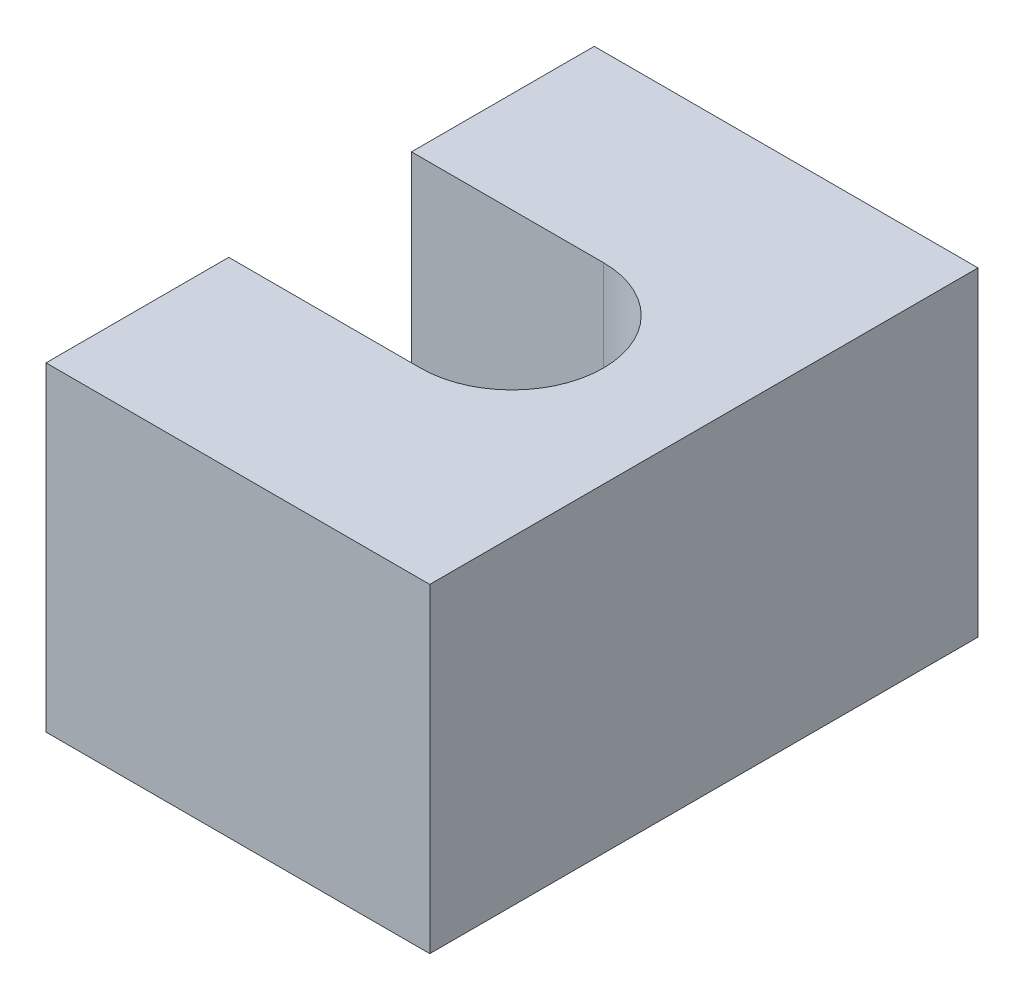
from build123d import *

# Parameters (mm, degrees)
SKETCH1_W           = 42
SKETCH1_H           = 60
BOSS_EXTRUDE1_DEPTH = 10
BOSS_EXTRUDE2_DEPTH = 25
SKETCH3_R           = 4
CUT_EXTRUDE1_DEPTH  = 15
SKETCH4_R           = 2.5
CUT_EXTRUDE2_DEPTH  = 15


with BuildPart() as part:
    # Sketch1 → Boss-Extrude1 (new body)
    with BuildSketch(Plane(origin=(0, 0, 0), x_dir=(1, 0, 0), z_dir=(0, 1, 0))):
        with Locations((21, 30)):
            Rectangle(SKETCH1_W, SKETCH1_H)
    extrude(amount=BOSS_EXTRUDE1_DEPTH)

    # Sketch2 → Boss-Extrude2 (add)
    with BuildSketch(Plane(origin=(0, 10, 0), x_dir=(1, 0, 0), z_dir=(0, 1, 0))):
        with BuildLine():
            Line((0, 20), (21, 20))
            ThreePointArc((21, 20), (31, 30), (21, 40))
            Line((21, 40), (0, 40))
            Line((0, 40), (0, 60))
            Line((0, 60), (42, 60))
            Line((42, 60), (42, 0))
            Line((42, 0), (0, 0))
            Line((0, 0), (0, 20))
        make_face()
    extrude(amount=BOSS_EXTRUDE2_DEPTH)

    # Sketch3 → Cut-Extrude1 (cut)
    with BuildSketch(Plane.ZY):
        with Locations((-10, 22.5)):
            Circle(SKETCH3_R)
        with Locations(Location((-50, 22.5, 0), (0, 0, 180))):
            Circle(SKETCH3_R)
    extrude(amount=-CUT_EXTRUDE1_DEPTH, mode=Mode.SUBTRACT)

    # Sketch4 → Cut-Extrude2 (cut)
    with BuildSketch(Plane(origin=(0, 10, 0), x_dir=(1, 0, 0), z_dir=(0, 1, 0))):
        with Locations(Location((20.85, 30, 0), (0, 0, 270))):
            Circle(SKETCH4_R)
    extrude(amount=-CUT_EXTRUDE2_DEPTH, mode=Mode.SUBTRACT)


solid = part.part
